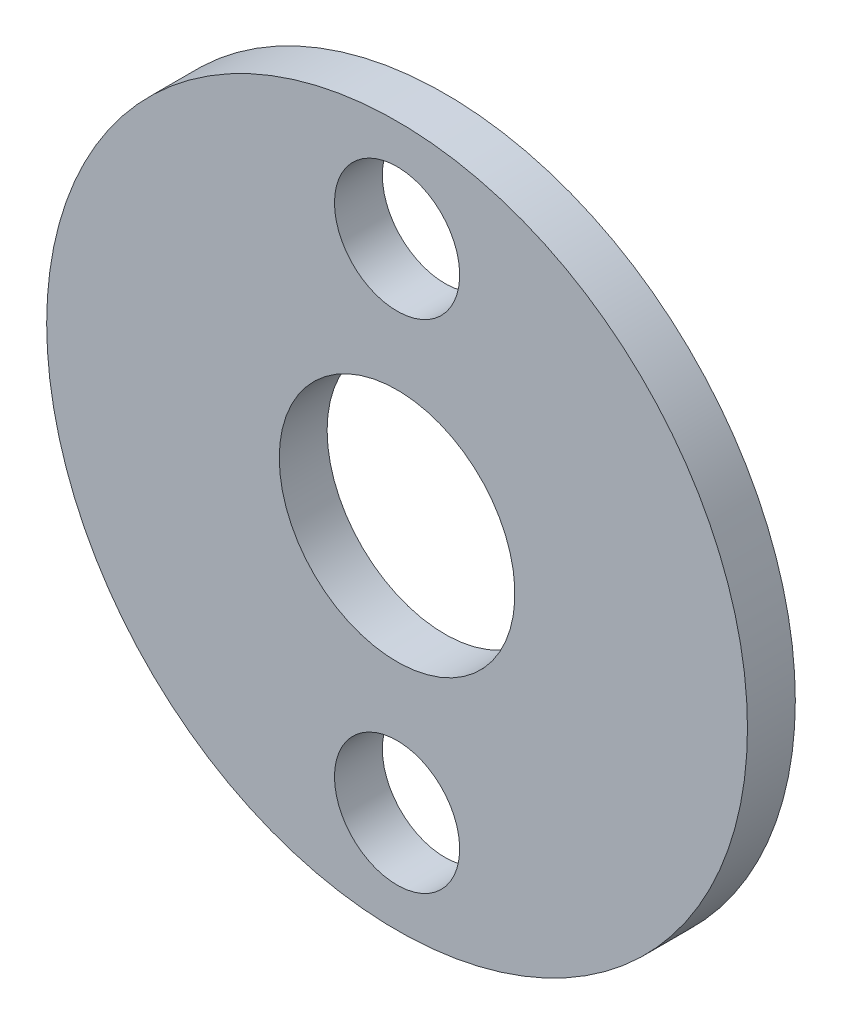
from build123d import *

# Parameters (mm, degrees)
SKETCH1_R           = 12.087172939
SKETCH1_R_2         = 4.064
SKETCH1_R_3         = 2.159
BOSS_EXTRUDE1_DEPTH = 1.651


with BuildPart() as part:
    # Sketch1 → Boss-Extrude1 (new body)
    with BuildSketch(Plane.XY):
        with Locations(Location((0, 0, 0), (0, 0, 180))):
            Circle(SKETCH1_R)
        with Locations(Location((0, 0, 0), (0, 0, 180))):
            Circle(SKETCH1_R_2, mode=Mode.SUBTRACT)
        with Locations(Location((0, 8.5725, 0), (0, 0, 180))):
            Circle(SKETCH1_R_3, mode=Mode.SUBTRACT)
        with Locations(Location((0, -8.5725, 0), (0, 0, 180))):
            Circle(SKETCH1_R_3, mode=Mode.SUBTRACT)
    extrude(amount=BOSS_EXTRUDE1_DEPTH)


solid = part.part
